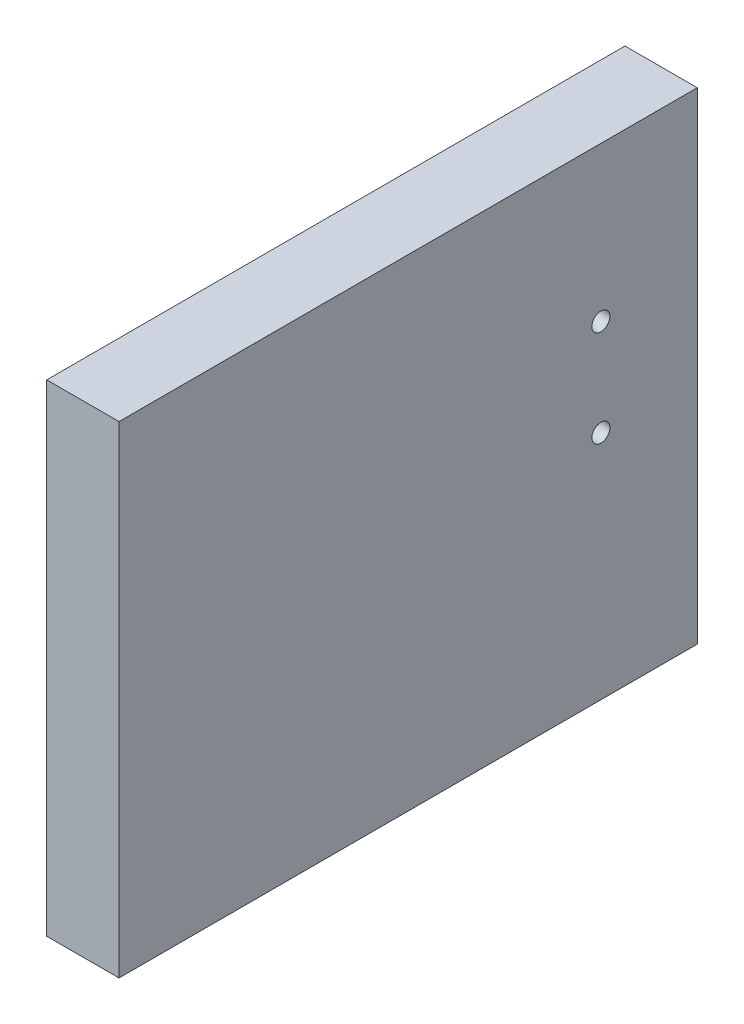
from build123d import *

# Parameters (mm, degrees)
SKETCH1_W           = 19.05
SKETCH1_H           = 127
BOSS_EXTRUDE1_DEPTH = 152.4
SKETCH2_R           = 2.38125
CUT_EXTRUDE1_DEPTH  = 167.195404569


with BuildPart() as part:
    # Sketch1 → Boss-Extrude1 (new body)
    with BuildSketch(Plane.XY):
        Rectangle(SKETCH1_W, SKETCH1_H)
    extrude(amount=BOSS_EXTRUDE1_DEPTH)

    # Sketch2 → Cut-Extrude1 (cut, through all)
    with BuildSketch(Plane(origin=(9.525, 0, 0), x_dir=(0, 0, -1), z_dir=(1, 0, 0))):
        with Locations(Location((-25.4, 22.86, 0), (0, 0, 90))):
            Circle(SKETCH2_R)
        with Locations(Location((-25.4, -2.54, 0), (0, 0, 90))):
            Circle(SKETCH2_R)
    extrude(amount=-CUT_EXTRUDE1_DEPTH, mode=Mode.SUBTRACT)


solid = part.part
